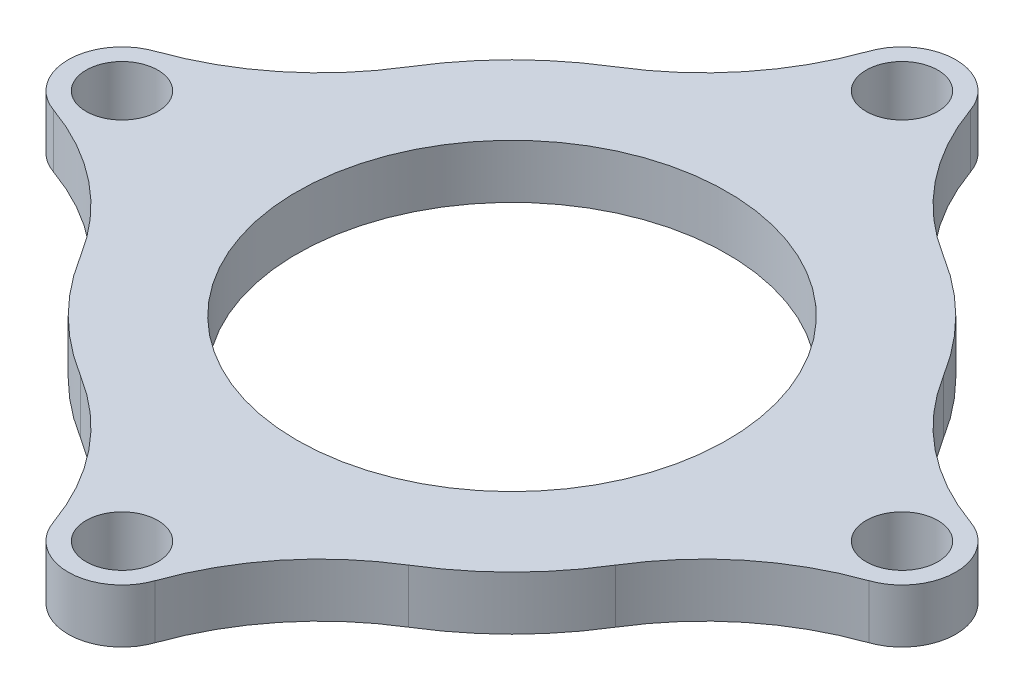
from build123d import *

# Parameters (mm, degrees)
SKETCH_1_R      = 12
SKETCH_1_R_2    = 2
EXTRUDE_1_DEPTH = 3


with BuildPart() as part:
    # ｽｹｯﾁ1 → ﾎﾞｽ - 押し出し1 (new body)
    with BuildSketch(Plane(origin=(0, 0, 0), x_dir=(1, 0, 0), z_dir=(0, 1, 0))):
        with BuildLine():
            ThreePointArc((-9.145896655, 14.919871795), (-12.374368671, 12.374368671), (-14.919871795, 9.145896655))
            ThreePointArc((-14.919871795, 9.145896655), (-18.286619233, 5.313420016), (-22.743055556, 2.830872774))
            ThreePointArc((-22.743055556, 2.830872774), (-24.75, 0), (-22.743055556, -2.830872774))
            ThreePointArc((-22.743055556, -2.830872774), (-18.286619233, -5.313420016), (-14.919871795, -9.145896655))
            ThreePointArc((-14.919871795, -9.145896655), (-12.374368671, -12.374368671), (-9.145896655, -14.919871795))
            ThreePointArc((-9.145896655, -14.919871795), (-5.313420016, -18.286619233), (-2.830872774, -22.743055556))
            ThreePointArc((-2.830872774, -22.743055556), (0, -24.75), (2.830872774, -22.743055556))
            ThreePointArc((2.830872774, -22.743055556), (5.313420016, -18.286619233), (9.145896655, -14.919871795))
            ThreePointArc((9.145896655, -14.919871795), (12.374368671, -12.374368671), (14.919871795, -9.145896655))
            ThreePointArc((14.919871795, -9.145896655), (18.286619233, -5.313420016), (22.743055556, -2.830872774))
            ThreePointArc((22.743055556, -2.830872774), (24.75, 0), (22.743055556, 2.830872774))
            ThreePointArc((22.743055556, 2.830872774), (18.286619233, 5.313420016), (14.919871795, 9.145896655))
            ThreePointArc((14.919871795, 9.145896655), (12.374368671, 12.374368671), (9.145896655, 14.919871795))
            ThreePointArc((9.145896655, 14.919871795), (5.313420016, 18.286619233), (2.830872774, 22.743055556))
            ThreePointArc((2.830872774, 22.743055556), (0, 24.75), (-2.830872774, 22.743055556))
            ThreePointArc((-2.830872774, 22.743055556), (-5.313420016, 18.286619233), (-9.145896655, 14.919871795))
        make_face()
        with Locations(Location((0, 0, 0), (0, 0, 270))):
            Circle(SKETCH_1_R, mode=Mode.SUBTRACT)
        with Locations(Location((0, 21.75, 0), (0, 0, 270))):
            Circle(SKETCH_1_R_2, mode=Mode.SUBTRACT)
        with Locations(Location((21.75, 0, 0), (0, 0, 270))):
            Circle(SKETCH_1_R_2, mode=Mode.SUBTRACT)
        with Locations(Location((0, -21.75, 0), (0, 0, 270))):
            Circle(SKETCH_1_R_2, mode=Mode.SUBTRACT)
        with Locations(Location((-21.75, 0, 0), (0, 0, 270))):
            Circle(SKETCH_1_R_2, mode=Mode.SUBTRACT)
    extrude(amount=EXTRUDE_1_DEPTH)


solid = part.part
